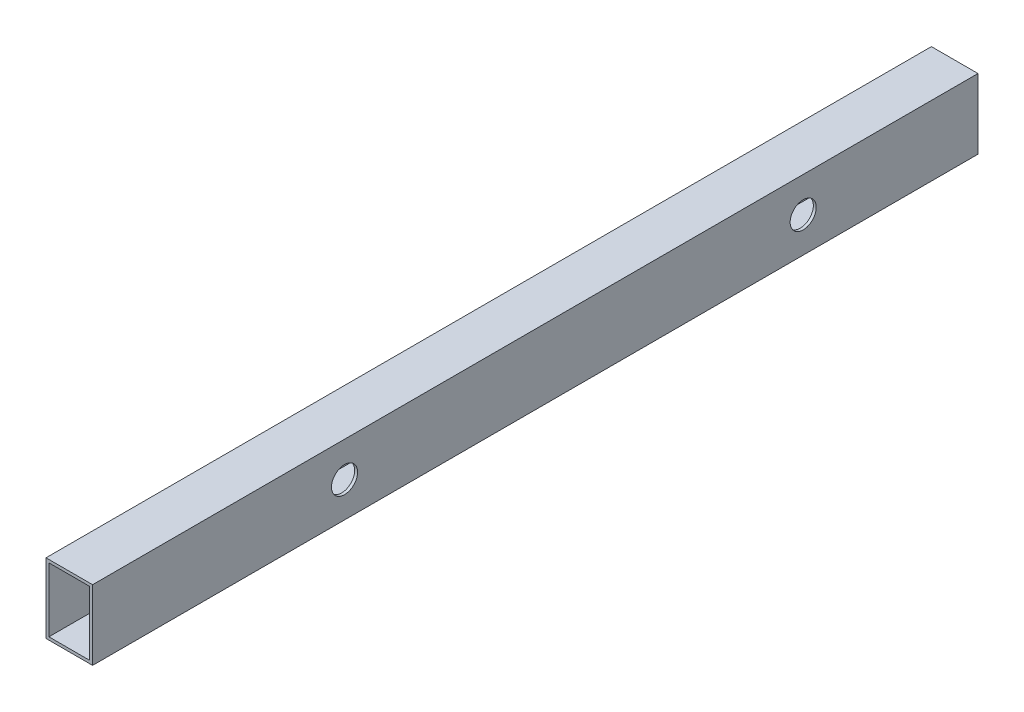
from build123d import *

# Parameters (mm, degrees)
SKETCH1_W           = 50.8
SKETCH1_H           = 76.2
SKETCH1_W_2         = 44.45
SKETCH1_H_2         = 69.85
BOSS_EXTRUDE1_DEPTH = 965.2
CUT_EXTRUDE1_REACH  = 969.287
SKETCH4_R           = 14.224


with BuildPart() as part:
    # Sketch1 → Boss-Extrude1 (new body)
    with BuildSketch(Plane.XY):
        Rectangle(SKETCH1_W, SKETCH1_H)
        Rectangle(SKETCH1_W_2, SKETCH1_H_2, mode=Mode.SUBTRACT)
    extrude(amount=BOSS_EXTRUDE1_DEPTH)

    # Cut-Extrude1: up to this face of the body (flat: up to its plane)
    cut_extrude1_end = Plane(part.part.faces().sort_by_distance((-25.4, 0, 482.6))[0])
    # Sketch4 → Cut-Extrude1 (cut, up to the picked face)
    with BuildSketch(Plane(origin=(25.4, 0, 0), x_dir=(0, 0, -1), z_dir=(1, 0, 0)), mode=Mode.PRIVATE) as cut_extrude1_sk1:
        with Locations(Location((-690.548048411, 0, 0), (0, 0, 90))):
            Circle(SKETCH4_R)
    cut_extrude1_tool1 = split(extrude(cut_extrude1_sk1.sketch, amount=-CUT_EXTRUDE1_REACH, mode=Mode.PRIVATE), bisect_by=cut_extrude1_end, keep=Keep.BOTH, mode=Mode.PRIVATE)
    # Sketch4 → Cut-Extrude1 (cut, up to the picked face)
    with BuildSketch(Plane(origin=(25.4, 0, 0), x_dir=(0, 0, -1), z_dir=(1, 0, 0)), mode=Mode.PRIVATE) as cut_extrude1_sk2:
        with Locations(Location((-190.549048411, 0, 0), (0, 0, 90))):
            Circle(SKETCH4_R)
    cut_extrude1_tool2 = split(extrude(cut_extrude1_sk2.sketch, amount=-CUT_EXTRUDE1_REACH, mode=Mode.PRIVATE), bisect_by=cut_extrude1_end, keep=Keep.BOTH, mode=Mode.PRIVATE)
    add(cut_extrude1_tool1.solids().sort_by(Axis((25.4, 0, 690.548048), (-1, 0, 0)))[0], mode=Mode.SUBTRACT)
    add(cut_extrude1_tool2.solids().sort_by(Axis((25.4, 0, 190.549048), (-1, 0, 0)))[0], mode=Mode.SUBTRACT)


solid = part.part
